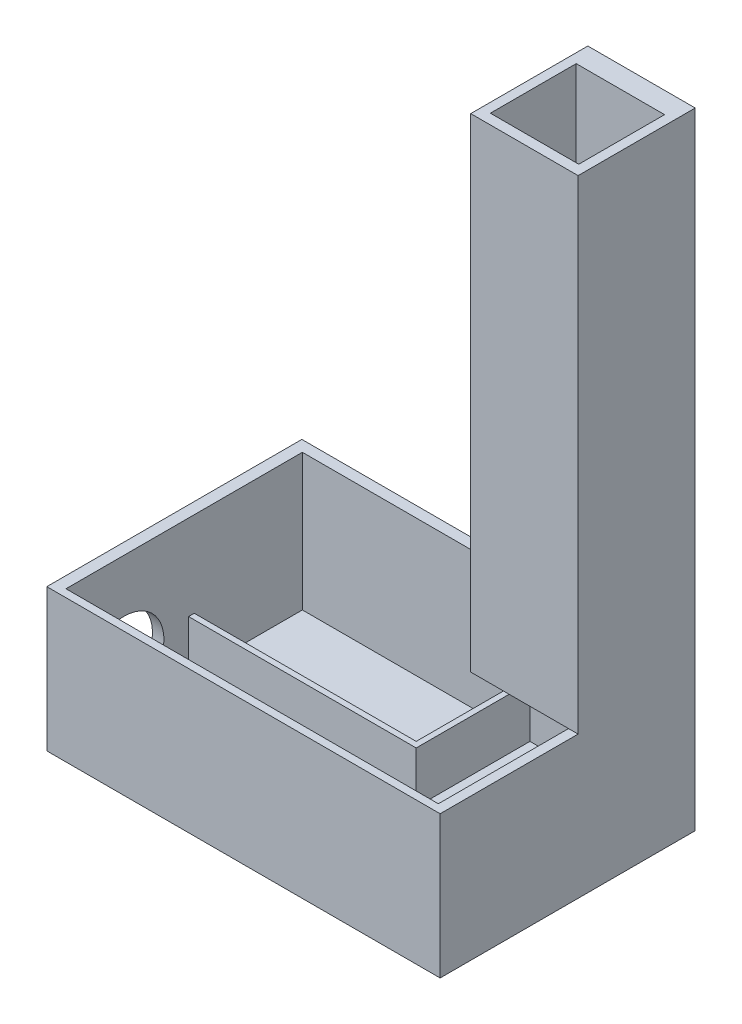
from build123d import *

# Parameters (mm, degrees)
SKETCH1_W           = 13.824903871
SKETCH1_H           = 8.964949161
BOSS_EXTRUDE1_DEPTH = 5
SKETCH2_W           = 13.088608924
SKETCH2_H           = 8.309427022
CUT_EXTRUDE1_DEPTH  = 4.8
BOSS_EXTRUDE2_DEPTH = 1.8
SKETCH4_R           = 1.4
CUT_EXTRUDE3_DEPTH  = 1.8
SKETCH7_W           = 0.440803266
SKETCH7_H           = 2.270686526
CUT_EXTRUDE4_DEPTH  = 18.162117599
SKETCH9_W           = 3.10665333
SKETCH9_H           = 3.017419
BOSS_EXTRUDE3_DEPTH = 17
SKETCH11_W          = 3.315667702
SKETCH11_H          = 0.539606784
CUT_EXTRUDE11_DEPTH = 1


with BuildPart() as part:
    # Sketch1 → Boss-Extrude1 (new body)
    with BuildSketch(Plane(origin=(0, 0, 0), x_dir=(1, 0, 0), z_dir=(0, 1, 0))):
        with Locations((6.912451936, -4.48247458)):
            Rectangle(SKETCH1_W, SKETCH1_H)
    extrude(amount=BOSS_EXTRUDE1_DEPTH)

    # Sketch2 → Cut-Extrude1 (cut)
    with BuildSketch(Plane(origin=(0, 5, 0), x_dir=(1, 0, 0), z_dir=(0, 1, 0))):
        with Locations((6.945565783, -4.53797661)):
            Rectangle(SKETCH2_W, SKETCH2_H)
    extrude(amount=-CUT_EXTRUDE1_DEPTH, mode=Mode.SUBTRACT)

    # Sketch3 → Boss-Extrude2 (add)
    with BuildSketch(Plane(origin=(0, 0.2, 0), x_dir=(1, 0, 0), z_dir=(0, 1, 0))):
        Polygon((8.401261321, -0.383263099), (8.201261321, -0.383263099), (8.201261321, -4.183263099), (0.401261321, -4.183263099), (0.401261321, -4.383263099), (8.401261321, -4.383263099), align=None)
    extrude(amount=BOSS_EXTRUDE2_DEPTH)

    # Sketch4 → Cut-Extrude3 (cut)
    with BuildSketch(Plane.ZY):
        with Locations((6.651943346, 1.742318178)):
            Circle(SKETCH4_R)
    extrude(amount=-CUT_EXTRUDE3_DEPTH, mode=Mode.SUBTRACT)

    # Sketch7 → Cut-Extrude4 (cut, through all)
    with BuildSketch(Plane(origin=(0, 0.2, 0), x_dir=(1, 0, 0), z_dir=(0, 1, 0))):
        with Locations((12.838352813, -7.176919556)):
            Rectangle(SKETCH7_W, SKETCH7_H)
    extrude(amount=-CUT_EXTRUDE4_DEPTH, mode=Mode.SUBTRACT)

    # Sketch9 → Boss-Extrude3 (add)
    with BuildSketch(Plane(origin=(0, 5, 0), x_dir=(1, 0, 0), z_dir=(0, 1, 0))):
        Polygon((13.489870245, -4.115580834), (10.0509272, -4.115580834), (10.0509272, -0.383263099), (10.0509272, 0), (13.824903871, 0), (13.824903871, -4.115580834), align=None)
        with Locations((11.93654358, -2.24927503)):
            Rectangle(SKETCH9_W, SKETCH9_H, mode=Mode.SUBTRACT)
    extrude(amount=BOSS_EXTRUDE3_DEPTH)

    # Sketch11 → Cut-Extrude11 (cut)
    with BuildSketch(Plane(origin=(0, 0, 0), x_dir=(-1, 0, 0), z_dir=(0, 0, -1))):
        with Locations((-11.708761051, 4.669803392)):
            Rectangle(SKETCH11_W, SKETCH11_H)
    extrude(amount=-CUT_EXTRUDE11_DEPTH, mode=Mode.SUBTRACT)


solid = part.part
